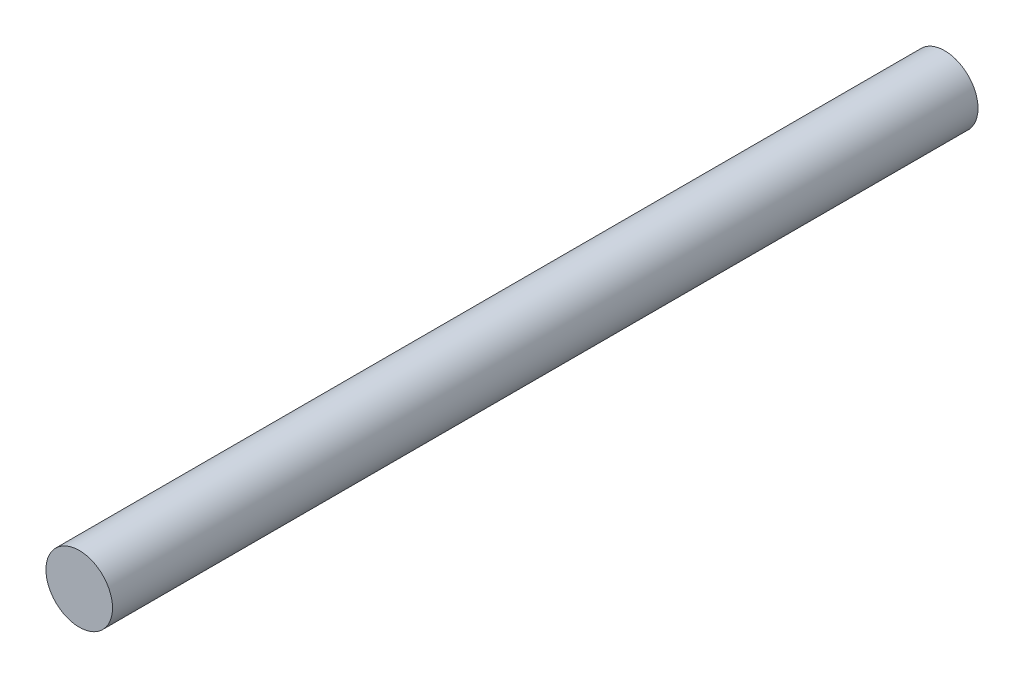
from build123d import *

# Parameters (mm, degrees)
SKETCH1_R           = 3.175
BOSS_EXTRUDE1_DEPTH = 82.55


with BuildPart() as part:
    # Sketch1 → Boss-Extrude1 (new body)
    with BuildSketch(Plane.XY):
        with Locations((-5.146673194, 5.633520658)):
            Circle(SKETCH1_R)
    extrude(amount=BOSS_EXTRUDE1_DEPTH)


solid = part.part
